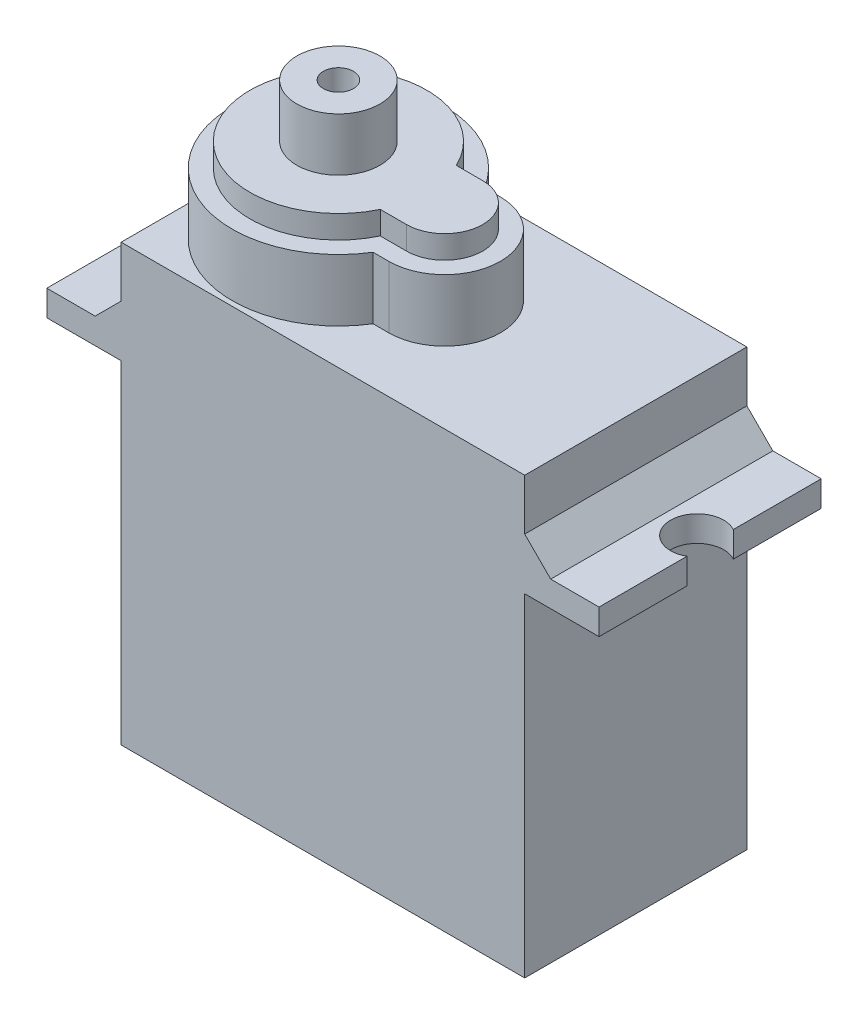
from build123d import *

# Parameters (mm, degrees)
ESTRUSIONE_ESTRUSIONE2_DEPTH = 12.55
ESTRUSIONE_ESTRUSIONE3_DEPTH = 3.5
ESTRUSIONE_ESTRUSIONE4_DEPTH = 1.3
SCHIZZO4_R                   = 2.35
SCHIZZO4_R_2                 = 0.85
ESTRUSIONE_ESTRUSIONE5_DEPTH = 3
TAGLIO_ESTRUSIONE1_REACH     = 30.477
SCHIZZO6_R                   = 1.5


with BuildPart() as part:
    # Schizzo1 → Estrusione-Estrusione2 (new body)
    with BuildSketch(Plane.XY):
        Polygon((11.4, 21.717893219), (12.867893219, 20.25), (15.6, 20.25), (15.6, 18.8), (11.4, 18.8), (11.4, 0), (-11.4, 0), (-11.4, 18.8), (-15.6, 18.8), (-15.6, 20.25), (-12.867893219, 20.25), (-11.4, 21.717893219), (-11.4, 24.6), (11.4, 24.6), align=None)
    extrude(amount=ESTRUSIONE_ESTRUSIONE2_DEPTH)

    # Schizzo2 → Estrusione-Estrusione3 (add)
    with BuildSketch(Plane(origin=(0, 24.6, 0), x_dir=(1, 0, 0), z_dir=(0, 1, 0))):
        with BuildLine():
            Line((0.6, -3.125), (-0.293386641, -3.125))
            ThreePointArc((-0.293386641, -3.125), (-11.4, -6.275), (-0.293386641, -9.425))
            Line((-0.293386641, -9.425), (0.6, -9.425))
            ThreePointArc((0.6, -9.425), (3.75, -6.275), (0.6, -3.125))
        make_face()
    extrude(amount=ESTRUSIONE_ESTRUSIONE3_DEPTH)

    # Schizzo3 → Estrusione-Estrusione4 (add)
    with BuildSketch(Plane(origin=(0, 28.1, 0), x_dir=(1, 0, 0), z_dir=(0, 1, 0))):
        with BuildLine():
            Line((-0.885855563, -8.425), (0.6, -8.425))
            ThreePointArc((0.6, -8.425), (2.75, -6.275), (0.6, -4.125))
            Line((0.6, -4.125), (-0.885855563, -4.125))
            ThreePointArc((-0.885855563, -4.125), (-10.4, -6.275), (-0.885855563, -8.425))
        make_face()
    extrude(amount=ESTRUSIONE_ESTRUSIONE4_DEPTH)

    # Schizzo4 → Estrusione-Estrusione5 (add)
    with BuildSketch(Plane(origin=(0, 29.4, 0), x_dir=(1, 0, 0), z_dir=(0, 1, 0))):
        with Locations(Location((-5.4, -6.275, 0), (0, 0, 270))):
            Circle(SCHIZZO4_R)
        with Locations(Location((-5.4, -6.275, 0), (0, 0, 270))):
            Circle(SCHIZZO4_R_2, mode=Mode.SUBTRACT)
    extrude(amount=ESTRUSIONE_ESTRUSIONE5_DEPTH)

    # Schizzo6 → Taglio-Estrusione1 (cut, up to next)
    with BuildSketch(Plane(origin=(0, 20.25, 0), x_dir=(1, 0, 0), z_dir=(0, 1, 0)), mode=Mode.PRIVATE) as taglio_estrusione1_sk1:
        with Locations((-14.867893219, -6.275)):
            Circle(SCHIZZO6_R)
    taglio_estrusione1_tool1 = extrude(taglio_estrusione1_sk1.sketch, amount=-TAGLIO_ESTRUSIONE1_REACH, mode=Mode.PRIVATE) & part.part
    # Schizzo6 → Taglio-Estrusione1 (cut, up to next)
    with BuildSketch(Plane(origin=(0, 20.25, 0), x_dir=(1, 0, 0), z_dir=(0, 1, 0)), mode=Mode.PRIVATE) as taglio_estrusione1_sk2:
        with Locations((14.867893219, -6.275)):
            Circle(SCHIZZO6_R)
    taglio_estrusione1_tool2 = extrude(taglio_estrusione1_sk2.sketch, amount=-TAGLIO_ESTRUSIONE1_REACH, mode=Mode.PRIVATE) & part.part
    add(taglio_estrusione1_tool1.solids().sort_by_distance((-14.867893, 20.25, 6.275))[0], mode=Mode.SUBTRACT)
    add(taglio_estrusione1_tool2.solids().sort_by_distance((14.867893, 20.25, 6.275))[0], mode=Mode.SUBTRACT)


solid = part.part
